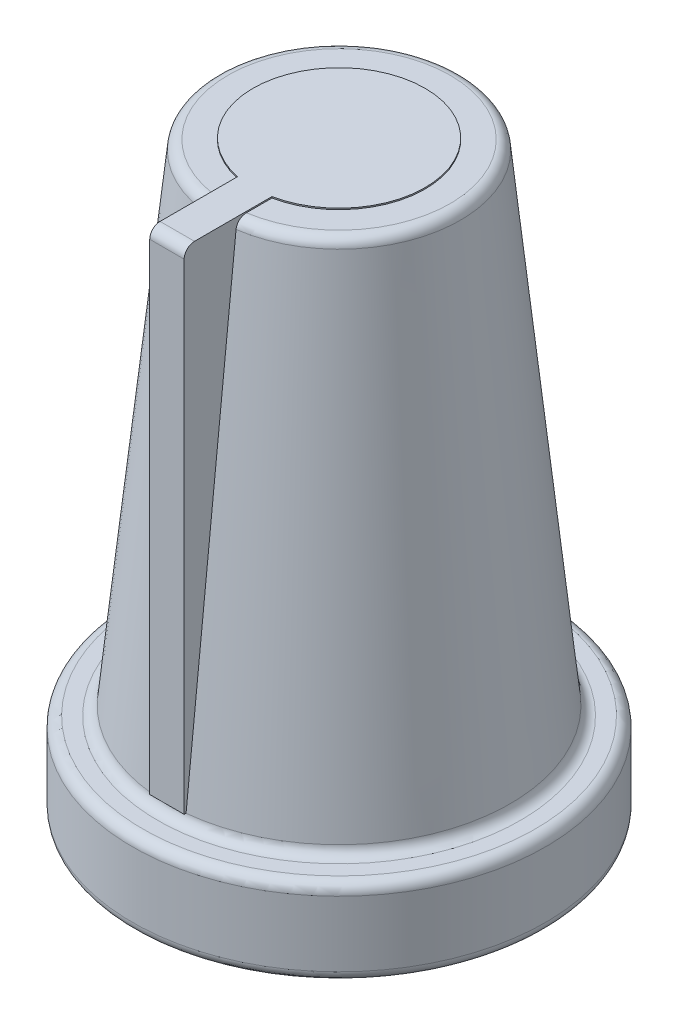
from build123d import *

# Parameters (mm, degrees)
CROQUIS2_W              = 1
CROQUIS2_H              = 14.230822787
SALIENTE_EXTRUIR1_DEPTH = 5
SALIENTE_EXTRUIR3_START = 0.6
SALIENTE_EXTRUIR3_DEPTH = 0.6
CORTAR_EXTRUIR1_DEPTH   = 10.6
CORTAR_EXTRUIR2_START   = -13.937546769
CROQUIS5_R              = 3
CORTAR_EXTRUIR2_DEPTH   = 13.937546769


with BuildPart() as part:
    # Croquis1 → Revolución1 (revolve)
    with BuildSketch(Plane.XY, mode=Mode.PRIVATE) as revoluci_n1_sk:
        with BuildLine():
            ThreePointArc((0.729390716, 10), (0.930329965, 9.922763143), (1.027803108, 9.730822787))
            Line((1.027803108, 9.730822787), (2.469890767, -4.230822787))
            ThreePointArc((2.469890767, -4.230822787), (2.56736391, -4.422763143), (2.768303159, -4.5))
            Line((2.768303159, -4.5), (3.2, -4.5))
            ThreePointArc((3.2, -4.5), (3.412132034, -4.587867966), (3.5, -4.8))
            Line((3.5, -4.8), (3.5, -6.7))
            ThreePointArc((3.5, -6.7), (3.412132034, -6.912132034), (3.2, -7))
            Line((3.2, -7), (3, -7))
            Line((3, -7), (3, -5.3))
            ThreePointArc((3, -5.3), (2.912132034, -5.087867966), (2.7, -5))
            Line((2.7, -5), (0.5, -5))
            Line((0.5, -5), (0.5, 8.637546769))
            ThreePointArc((0.5, 8.637546769), (0.412132034, 8.849678803), (0.2, 8.937546769))
            Line((0.2, 8.937546769), (-2.5, 8.937546769))
            Line((-2.5, 8.937546769), (-2.5, 9.437546769))
            Line((-2.5, 9.437546769), (0, 9.437546769))
            Line((0, 9.437546769), (0, 10))
            Line((0, 10), (0.729390716, 10))
        make_face()
    revolve(revoluci_n1_sk.sketch.rotate(Axis((-2.5, -7, 0), (0, 1, 0)), 90), axis=Axis((-2.5, -7, 0), (0, 1, 0)))

    # Croquis2 → Saliente-Extruir1 (add)
    with BuildSketch(Plane.XY):
        with Locations((-2.5, 2.884588606)):
            Rectangle(CROQUIS2_W, CROQUIS2_H)
    extrude(amount=SALIENTE_EXTRUIR1_DEPTH)

    # Croquis3 → Saliente-Extruir3 (add)
    with BuildSketch(Plane(origin=(0, 9.437546769, 0), x_dir=(1, 0, 0), z_dir=(0, 1, 0)).offset(SALIENTE_EXTRUIR3_START)):
        with BuildLine():
            Line((-3, -4.944675342), (-2, -5))
            Line((-2, -5), (-2, -2.449489743))
            ThreePointArc((-2, -2.449489743), (-2.5, 2.5), (-3, -2.449489743))
            Line((-3, -2.449489743), (-3, -4.944675342))
        make_face()
    extrude(amount=-SALIENTE_EXTRUIR3_DEPTH)

    # Croquis4 → Cortar-Extruir1 (cut)
    with BuildSketch(Plane(origin=(-2, 0, 0), x_dir=(0, 0, -1), z_dir=(1, 0, 0))):
        with BuildLine():
            Line((-5, 9.737546769), (-5, 10.037546769))
            Line((-5, 10.037546769), (-4.7, 10.037546769))
            ThreePointArc((-4.7, 10.037546769), (-4.912132034, 9.949678803), (-5, 9.737546769))
        make_face()
    extrude(amount=-CORTAR_EXTRUIR1_DEPTH, mode=Mode.SUBTRACT)

    # Croquis5 → Cortar-Extruir2 (cut)
    with BuildSketch(Plane.XZ.offset(5).offset(CORTAR_EXTRUIR2_START)):
        with Locations(Location((-2.5, 0, 0), (0, 0, 270))):
            Circle(CROQUIS5_R)
    extrude(amount=CORTAR_EXTRUIR2_DEPTH, mode=Mode.SUBTRACT)


solid = part.part
